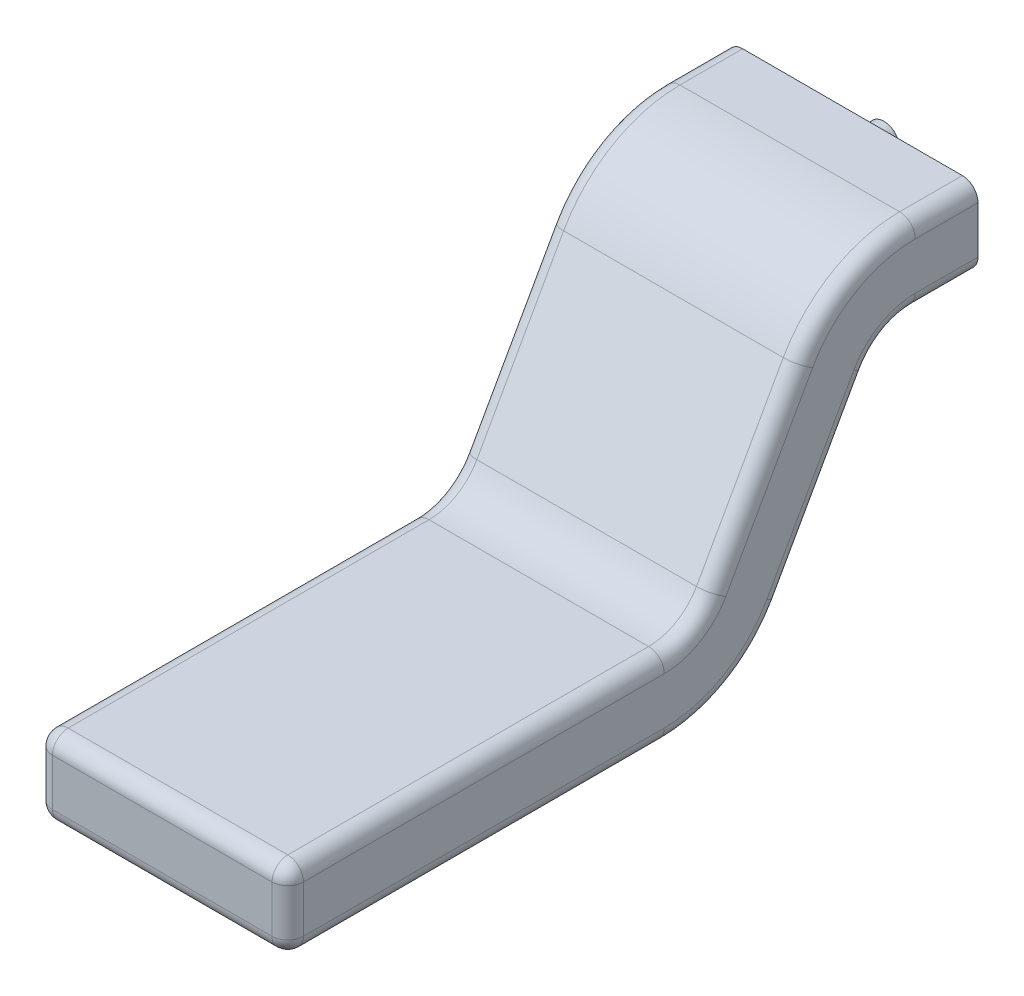
from build123d import *

# Parameters (mm, degrees)
FILETE2_R                = 0.05
ESBO_O3_R                = 0.05
RESSALTO_EXTRUS_O1_DEPTH = 0.1


with BuildPart() as part:
    # Varredura1: sweep along a path in Esboço2
    with BuildLine(Plane(origin=(0, 0, 0), x_dir=(0, 0, -1), z_dir=(1, 0, 0))) as varredura1_path:
        Line((0, 0), (1.2, 0))
        ThreePointArc((1.2, 0), (1.35163484, 0.041143137), (1.461678126, 0.153287497))
        Line((1.461678126, 0.153287497), (1.738321874, 0.646712503))
        ThreePointArc((1.738321874, 0.646712503), (1.84836516, 0.758856863), (2, 0.8))
        Line((2, 0.8), (2.2, 0.8))
    # Esboço1 → Varredura1 (sweep)
    with BuildSketch(Plane.XY):
        with BuildLine():
            Line((-0.35, -0.125), (0.35, -0.125))
            ThreePointArc((0.35, -0.125), (0.385355339, -0.110355339), (0.4, -0.075))
            Line((0.4, -0.075), (0.4, 0.075))
            ThreePointArc((0.4, 0.075), (0.385355339, 0.110355339), (0.35, 0.125))
            Line((0.35, 0.125), (-0.35, 0.125))
            ThreePointArc((-0.35, 0.125), (-0.385355339, 0.110355339), (-0.4, 0.075))
            Line((-0.4, 0.075), (-0.4, -0.075))
            ThreePointArc((-0.4, -0.075), (-0.385355339, -0.110355339), (-0.35, -0.125))
        make_face()
    sweep(path=varredura1_path.line)

    # Filete2
    filete2_edges = [part.edges().sort_by_distance(p)[0] for p in [
        (-0.4, 0, 0),
        (-0.385355339, 0.110355339, 0),
        (0, 0.125, 0),
        (0.385355339, 0.110355339, 0),
        (0.4, 0, 0),
        (0.385355339, -0.110355339, 0),
        (0, -0.125, 0),
        (-0.385355339, -0.110355339, 0),
    ]]
    fillet(filete2_edges, radius=FILETE2_R)

    # Esboço3 → Ressalto-extrusão1 (add)
    with BuildSketch(Plane(origin=(0, 0, -2.2), x_dir=(-1, 0, 0), z_dir=(0, 0, -1))):
        with Locations(Location((0, 0.8, 0), (0, 0, 270))):
            Circle(ESBO_O3_R)
    extrude(amount=RESSALTO_EXTRUS_O1_DEPTH)


solid = part.part
